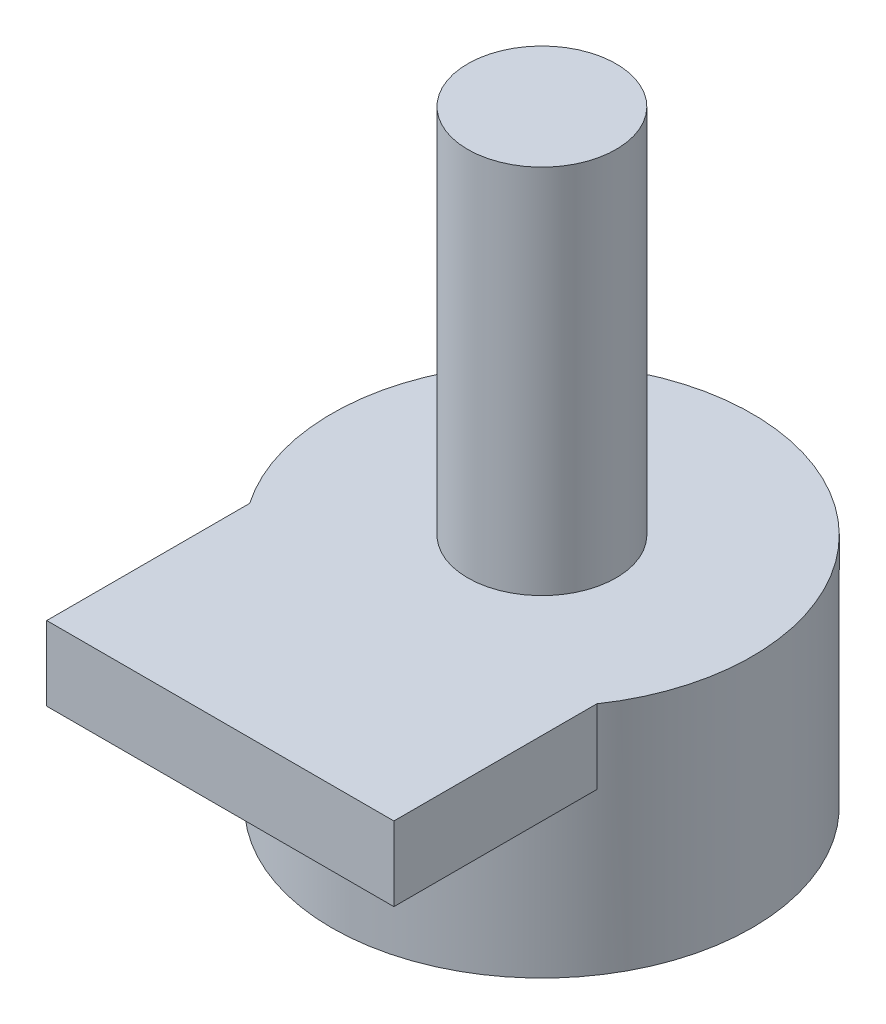
from build123d import *

# Parameters (mm, degrees)
SKETCH1_R           = 8.5
BOSS_EXTRUDE1_DEPTH = 9.5
SKETCH2_R           = 3
BOSS_EXTRUDE2_DEPTH = 15
SKETCH3_W           = 16.912520663
SKETCH3_H           = 13
BOSS_EXTRUDE3_DEPTH = 3
CUT_EXTRUDE2_DEPTH  = 24.774986856


with BuildPart() as part:
    # Sketch1 → Boss-Extrude1 (new body)
    with BuildSketch(Plane(origin=(0, 0, 0), x_dir=(1, 0, 0), z_dir=(0, 1, 0))):
        with Locations(Location((0, 0, 0), (0, 0, 270))):
            Circle(SKETCH1_R)
    extrude(amount=BOSS_EXTRUDE1_DEPTH)

    # Sketch2 → Boss-Extrude2 (add)
    with BuildSketch(Plane(origin=(0, 9.5, 0), x_dir=(1, 0, 0), z_dir=(0, 1, 0))):
        with Locations(Location((0, 0, 0), (0, 0, 270))):
            Circle(SKETCH2_R)
    extrude(amount=BOSS_EXTRUDE2_DEPTH)

    # Sketch3 → Boss-Extrude3 (add)
    with BuildSketch(Plane(origin=(0, 9.5, 0), x_dir=(1, 0, 0), z_dir=(0, 1, 0))):
        with Locations((0.043739668, -6.5)):
            Rectangle(SKETCH3_W, SKETCH3_H)
    extrude(amount=-BOSS_EXTRUDE3_DEPTH)

    # Sketch4 → Cut-Extrude2 (cut, through all)
    with BuildSketch(Plane.XZ.offset(-6.5)):
        with BuildLine():
            Line((-7.016472339, 13), (-7.016472339, 4.797824081))
            ThreePointArc((-7.016472339, 4.797824081), (-7.919608809, 3.087036818), (-8.412520663, 1.216345382))
            Line((-8.412520663, 1.216345382), (-8.412520663, 13))
            Line((-8.412520663, 13), (-7.016472339, 13))
        make_face()
        with BuildLine():
            Line((7.016472339, 13), (7.016472339, 4.797824081))
            ThreePointArc((7.016472339, 4.797824081), (8.120653141, 2.510974424), (8.5, 0))
            Line((8.5, 0), (8.5, 13))
            Line((8.5, 13), (7.016472339, 13))
        make_face()
    extrude(amount=-CUT_EXTRUDE2_DEPTH, mode=Mode.SUBTRACT)


solid = part.part
